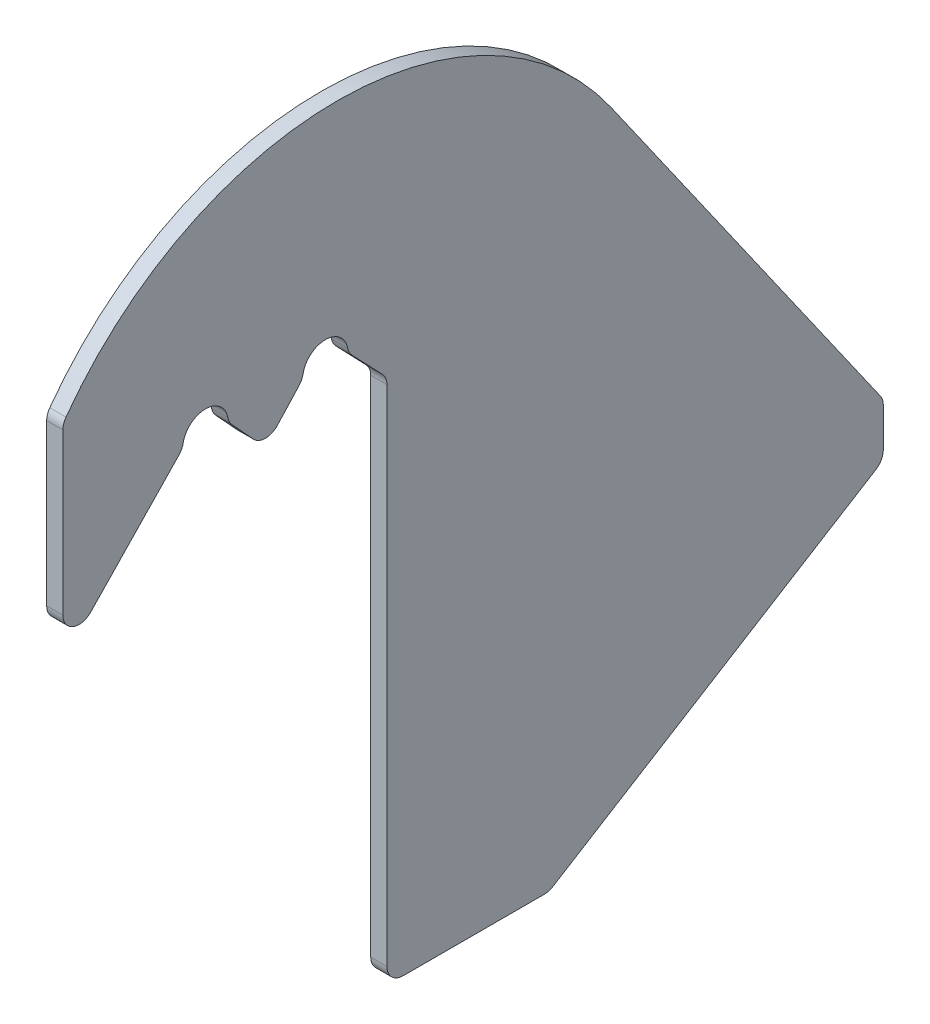
from build123d import *

# Parameters (mm, degrees)
BOSS_EXTRUDE1_DEPTH = 2.54
FILLET1_R           = 2.54


with BuildPart() as part:
    # Sketch1 → Boss-Extrude1 (new body)
    with BuildSketch(Plane(origin=(0, 0, 0), x_dir=(0, 0, -1), z_dir=(1, 0, 0))):
        with BuildLine():
            ThreePointArc((-57.404, 88.9), (-53.848, 92.456), (-50.292, 88.9))
            Line((-50.292, 88.9), (-44.45, 82.55))
            Line((-44.45, 82.55), (-38.608, 88.9))
            ThreePointArc((-38.608, 88.9), (-35.052, 92.456), (-31.496, 88.9))
            Line((-31.496, 88.9), (-25.4, 82.55))
            Line((-25.4, 82.55), (-25.4, 0))
            Line((-25.4, 0), (0, 0))
            Line((0, 0), (52.41925, 32.385))
            Line((52.41925, 32.385), (52.41925, 40.64))
            Line((52.41925, 40.64), (9.734598471, 101.6))
            ThreePointArc((9.734598471, 101.6), (-33.232700765, 123.967360233), (-76.2, 101.6))
            Line((-76.2, 101.6), (-76.2, 69.320833333))
            Line((-76.2, 69.320833333), (-57.404, 88.9))
        make_face()
    extrude(amount=BOSS_EXTRUDE1_DEPTH)

    # Fillet1
    fillet1_edges = [part.edges().sort_by_distance(p)[0] for p in [
        (1.27, 40.64, -52.41925),
        (1.27, 32.385, -52.41925),
        (1.27, 0, 0),
        (1.27, 0, 25.4),
        (1.27, 82.55, 25.4),
        (1.27, 88.9, 31.496),
        (1.27, 88.9, 38.608),
        (1.27, 82.55, 44.45),
        (1.27, 88.9, 50.292),
        (1.27, 88.9, 57.404),
        (1.27, 69.320833333, 76.2),
        (1.27, 101.6, 76.2),
    ]]
    fillet(fillet1_edges, radius=FILLET1_R)


solid = part.part
